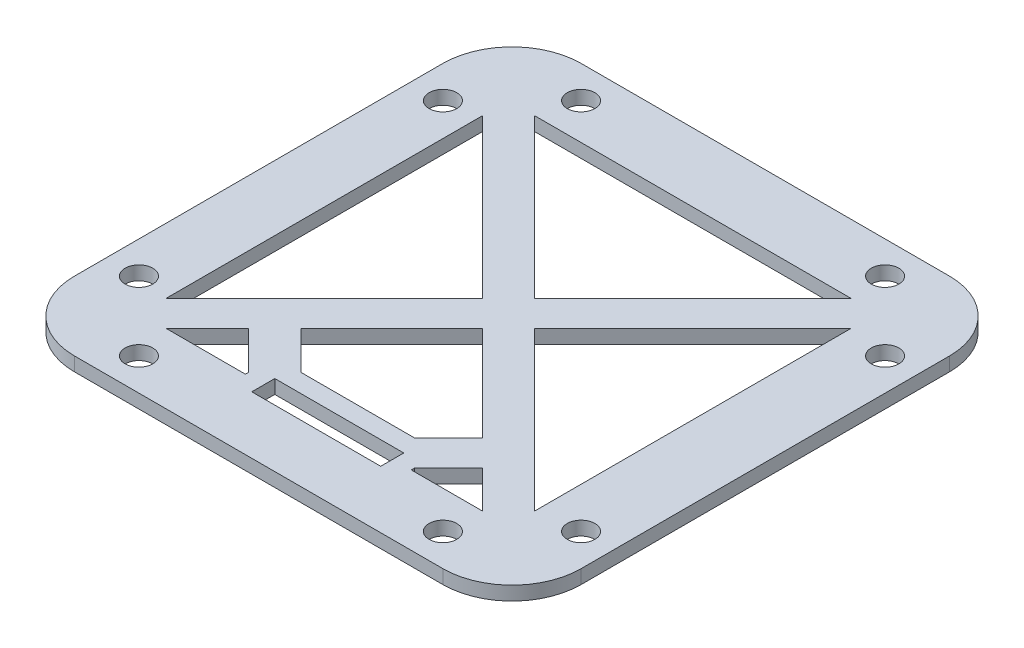
from build123d import *

# Parameters (mm, degrees)
SKETCH1_R           = 3
BOSS_EXTRUDE1_DEPTH = 3
SKETCH2_W           = 28
SKETCH2_H           = 5
CUT_EXTRUDE1_DEPTH  = 79.545892535
CUT_EXTRUDE2_DEPTH  = 79.545892535


with BuildPart() as part:
    # Sketch1 → Boss-Extrude1 (new body)
    with BuildSketch(Plane(origin=(0, 0, 0), x_dir=(1, 0, 0), z_dir=(0, 1, 0))):
        with BuildLine():
            Line((55.872458647, -40.12463695), (55.872458647, 39.87536305))
            ThreePointArc((55.872458647, 39.87536305), (51.479060365, 50.481964768), (40.872458647, 54.87536305))
            Line((40.872458647, 54.87536305), (-39.127541353, 54.87536305))
            ThreePointArc((-39.127541353, 54.87536305), (-49.734143071, 50.481964768), (-54.127541353, 39.87536305))
            Line((-54.127541353, 39.87536305), (-54.127541353, -40.12463695))
            ThreePointArc((-54.127541353, -40.12463695), (-49.734143071, -50.731238667), (-39.127541353, -55.12463695))
            Line((-39.127541353, -55.12463695), (40.872458647, -55.12463695))
            ThreePointArc((40.872458647, -55.12463695), (51.479060365, -50.731238667), (55.872458647, -40.12463695))
        make_face()
        with Locations(Location((48.872458647, 32.87536305, 0), (0, 0, 270))):
            Circle(SKETCH1_R, mode=Mode.SUBTRACT)
        with Locations(Location((-47.127541353, -33.12463695, 0), (0, 0, 270))):
            Circle(SKETCH1_R, mode=Mode.SUBTRACT)
        with Locations(Location((-32.127541353, -48.12463695, 0), (0, 0, 270))):
            Circle(SKETCH1_R, mode=Mode.SUBTRACT)
        with Locations(Location((33.872458647, -48.12463695, 0), (0, 0, 270))):
            Circle(SKETCH1_R, mode=Mode.SUBTRACT)
        with Locations(Location((48.872458647, -33.12463695, 0), (0, 0, 270))):
            Circle(SKETCH1_R, mode=Mode.SUBTRACT)
        with Locations(Location((33.872458647, 47.87536305, 0), (0, 0, 270))):
            Circle(SKETCH1_R, mode=Mode.SUBTRACT)
        with Locations(Location((-32.127541353, 47.87536305, 0), (0, 0, 270))):
            Circle(SKETCH1_R, mode=Mode.SUBTRACT)
        with Locations(Location((-47.127541353, 32.87536305, 0), (0, 0, 270))):
            Circle(SKETCH1_R, mode=Mode.SUBTRACT)
    extrude(amount=BOSS_EXTRUDE1_DEPTH)

    # Sketch2 → Cut-Extrude1 (cut, through all)
    with BuildSketch(Plane(origin=(0, 3, 0), x_dir=(1, 0, 0), z_dir=(0, 1, 0))):
        with Locations((0.872458647, -40.12463695)):
            Rectangle(SKETCH2_W, SKETCH2_H)
    extrude(amount=-CUT_EXTRUDE1_DEPTH, mode=Mode.SUBTRACT)

    # Sketch3 → Cut-Extrude2 (cut, through all)
    with BuildSketch(Plane(origin=(0, 3, 0), x_dir=(1, 0, 0), z_dir=(0, 1, 0))):
        Polygon((40, -34.343145751), (5.656854249, 0), (40, 34.343145751), align=None)
        Polygon((34.343145751, -40), (18.872458647, -40), (18.872458647, -39.281491199), (26.248547798, -31.905402048), align=None)
        Polygon((34.343145751, 40), (-34.343145751, 40), (0, 5.656854249), align=None)
        Polygon((-40, -34.343145751), (-40, 34.343145751), (-5.656854249, 0), align=None)
        Polygon((0, -5.656854249), (-19.719234902, -25.376089151), (-11.470687104, -33.62463695), (13.215604397, -33.62463695), (20.591693549, -26.248547798), align=None)
        Polygon((-17.127541353, -39.281491199), (-17.127541353, -40), (-34.343145751, -40), (-25.376089151, -31.032943401), align=None)
    extrude(amount=-CUT_EXTRUDE2_DEPTH, mode=Mode.SUBTRACT)


solid = part.part
